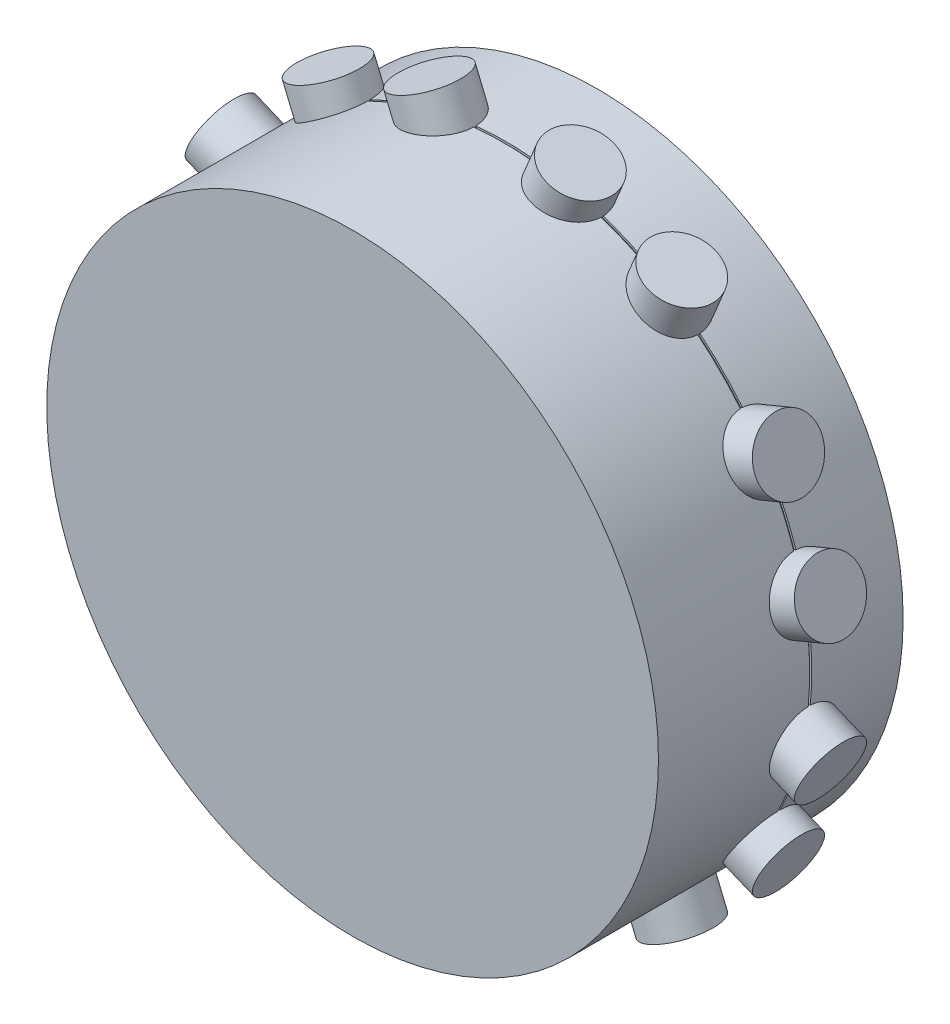
from build123d import *

# Parameters (mm, degrees)
SKIZZE3_R                 = 72.5
BASE_DEPTH                = 58
SKIZZE6_W                 = 0.5
SKIZZE6_H                 = 0.5
HC_SR04_REACH             = 183.295
SKIZZE5_R                 = 8
HC_SR04_DIRECTION_2_DEPTH = 5.65
KREISMUSTER1_COUNT        = 8


with BuildPart() as part:
    # Skizze3 → Base (new body)
    with BuildSketch(Plane.XY):
        with Locations(Location((0, 0, 0), (0, 0, 180))):
            Circle(SKIZZE3_R)
    extrude(amount=BASE_DEPTH)

    # Skizze6 → Ring Marking (revolve, cut)
    with BuildSketch(Plane(origin=(0, 0, 0), x_dir=(1, 0, 0), z_dir=(0, 1, 0))):
        with Locations((-72.25, -21.9)):
            Rectangle(SKIZZE6_W, SKIZZE6_H)
    revolve(axis=Axis((0, 0, 0), (0, 0, 1)), mode=Mode.SUBTRACT)

    # Skizze5 → HC-SR04 (add, up to next)
    with BuildSketch(Plane(origin=(66.981266107, 27.744548846, 0), x_dir=(0.38268343236509017, -0.9238795325112866, 0), z_dir=(-0.9238795325112866, -0.38268343236509017, 0)), mode=Mode.PRIVATE) as hc_sr04_sk1:
        with Locations((-13, 21.9)):
            Circle(SKIZZE5_R)
    hc_sr04_tool1 = extrude(hc_sr04_sk1.sketch, amount=HC_SR04_REACH, mode=Mode.PRIVATE) - part.part
    # Skizze5 → HC-SR04 (add, up to next)
    with BuildSketch(Plane(origin=(66.981266107, 27.744548846, 0), x_dir=(0.38268343236509017, -0.9238795325112866, 0), z_dir=(-0.9238795325112866, -0.38268343236509017, 0)), mode=Mode.PRIVATE) as hc_sr04_sk2:
        with Locations((13, 21.9)):
            Circle(SKIZZE5_R)
    hc_sr04_tool2 = extrude(hc_sr04_sk2.sketch, amount=HC_SR04_REACH, mode=Mode.PRIVATE) - part.part
    hc_sr04_1 = hc_sr04_tool1.solids().sort_by_distance((62.006381, 39.754983, 21.9))[0]
    add(hc_sr04_1)
    hc_sr04_2 = hc_sr04_tool2.solids().sort_by_distance((71.956151, 15.734115, 21.9))[0]
    add(hc_sr04_2)
    hc_sr04 = hc_sr04_1 + hc_sr04_2  # HC-SR04 as one shape, for the pattern or mirror that repeats it

    # Skizze5 → HC-SR04 direction 2 (add)
    with BuildSketch(Plane(origin=(66.981266107, 27.744548846, 0), x_dir=(0.38268343236509017, -0.9238795325112866, 0), z_dir=(-0.9238795325112866, -0.38268343236509017, 0))):
        with Locations((-13, 21.9)):
            Circle(SKIZZE5_R)
        with Locations((13, 21.9)):
            Circle(SKIZZE5_R)
    hc_sr04_direction_2 = extrude(amount=-HC_SR04_DIRECTION_2_DEPTH)

    # Kreismuster1: HC-SR04, HC-SR04 direction 2 ×8 about axis
    kreismuster1_axis = Axis((0, 0, 0), (0, 0, 1))
    add([hc_sr04.rotate(kreismuster1_axis, i * 360 / KREISMUSTER1_COUNT) for i in range(1, KREISMUSTER1_COUNT)])
    add([hc_sr04_direction_2.rotate(kreismuster1_axis, i * 360 / KREISMUSTER1_COUNT) for i in range(1, KREISMUSTER1_COUNT)])


solid = part.part
